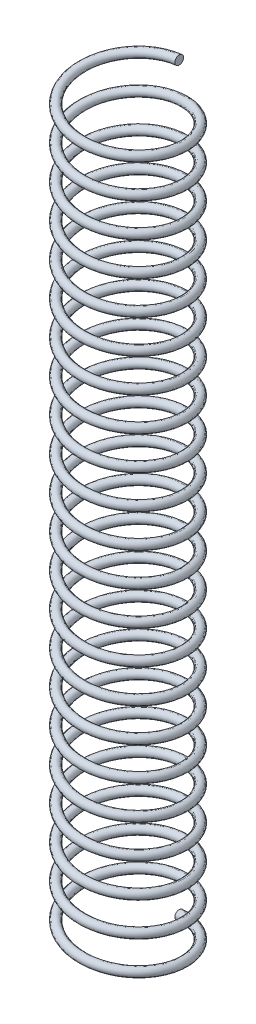
from build123d import *

# Parameters (mm, degrees)
SWEEP1_PITCH       = 4.6
SWEEP1_HEIGHT      = 101.2
SWEEP1_RADIUS      = 7
SWEEP1_START_ANGLE = -180
SKETCH3_R          = 0.6


with BuildPart() as part:
    # Sweep1: sweep along a helix
    with BuildLine() as sweep1_path:
        add(Helix(SWEEP1_PITCH, SWEEP1_HEIGHT, SWEEP1_RADIUS, center=(0, 0, 0), direction=(0, 1, 0), lefthand=True, mode=Mode.PRIVATE).rotate(Axis((0, 0, 0), (0, 1, 0)), SWEEP1_START_ANGLE))
    # Sketch3 → Sweep1 (sweep)
    with BuildSketch(Plane(origin=(0, 0, 0), x_dir=(0, 0, -1), z_dir=(1, 0, 0))):
        with Locations((7, 0)):
            Circle(SKETCH3_R)
    sweep(path=sweep1_path.line, is_frenet=True)


solid = part.part
